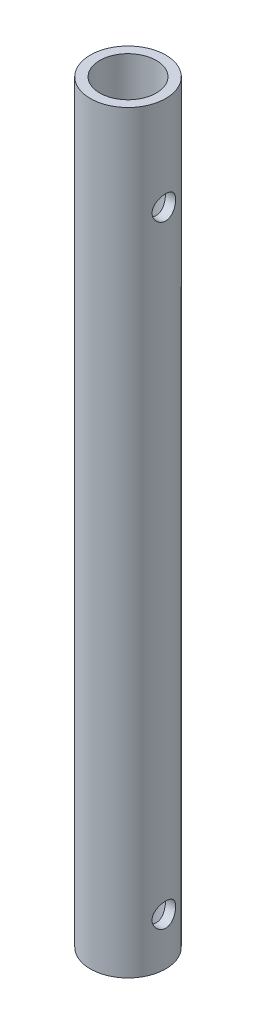
from build123d import *

# Parameters (mm, degrees)
SKETCH2_W               = 1
SKETCH2_H               = 80
CUT_EXTRUDE1_DEPTH      = 81.199750623
CUT_EXTRUDE1_DEPTH_BACK = 81.199750623
SKETCH3_R               = 1.25


with BuildPart() as part:
    # Sketch2 → revolve 1 (revolve)
    with BuildSketch(Plane(origin=(0, 0, 0), x_dir=(0, 0, -1), z_dir=(1, 0, 0))):
        with Locations((3.5, 40)):
            Rectangle(SKETCH2_W, SKETCH2_H)
    revolve(axis=Axis((0, 0, 0), (0, 1, 0)))

    # Sketch3 → Cut-Extrude1 (cut, two sides: drawn at the far end of the back side and taken through both)
    with BuildSketch(Plane(origin=(0, 0, 0), x_dir=(0, 0, -1), z_dir=(1, 0, 0)).offset(-CUT_EXTRUDE1_DEPTH_BACK)):
        with Locations((0, 5)):
            Circle(SKETCH3_R)
        with Locations((0, 70)):
            Circle(SKETCH3_R)
    extrude(amount=CUT_EXTRUDE1_DEPTH + CUT_EXTRUDE1_DEPTH_BACK, mode=Mode.SUBTRACT)


solid = part.part
